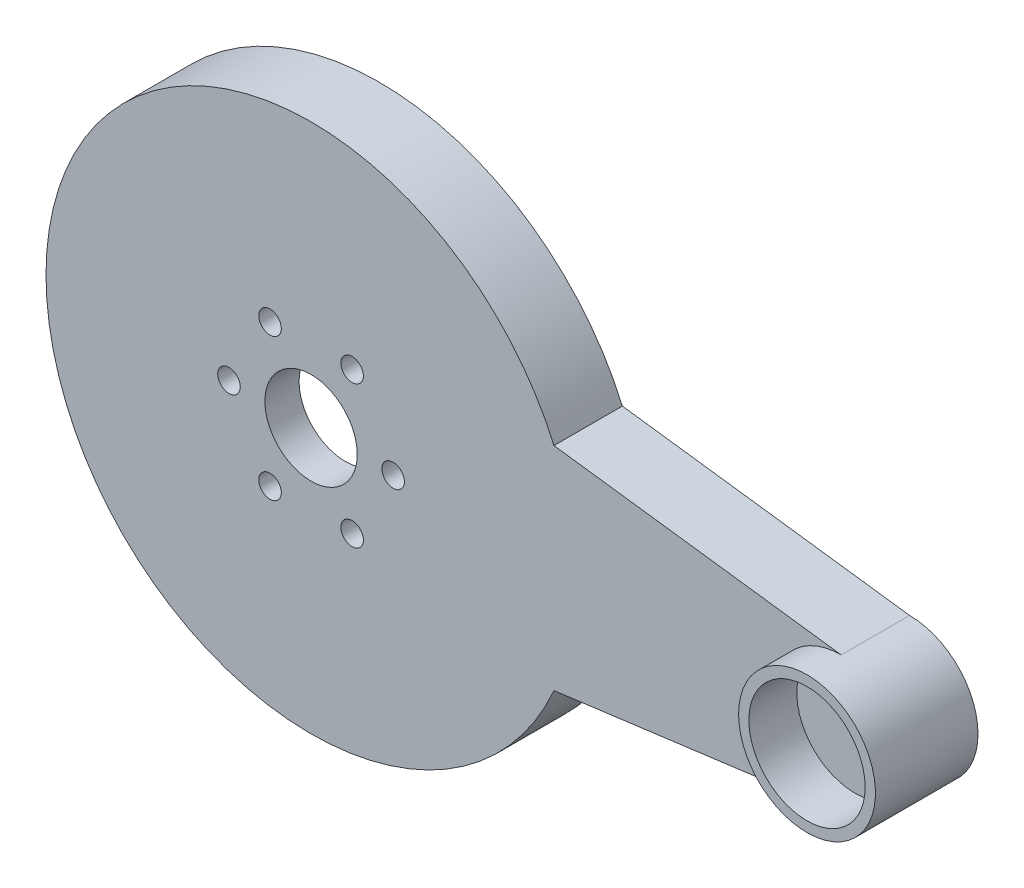
from build123d import *

# Parameters (mm, degrees)
BOSS_EXTRUDE1_DEPTH = 10
SKETCH2_R           = 6.75
SKETCH2_R_2         = 1.65
CUT_EXTRUDE1_DEPTH  = 97.21752699
SKETCH3_W           = 15
SKETCH3_H           = 5
SKETCH4_R           = 10
BOSS_EXTRUDE2_DEPTH = 15
SKETCH5_R           = 8.5
CUT_EXTRUDE2_DEPTH  = 7


with BuildPart() as part:
    # Sketch1 → Boss-Extrude1 (new body)
    with BuildSketch(Plane.XY):
        with BuildLine():
            ThreePointArc((35.510171199, 15.510971646), (-38.75, 0), (35.510171199, -15.510971646))
            Line((35.510171199, -15.510971646), (77.5, -10))
            ThreePointArc((77.5, -10), (87.5, 0), (77.5, 10))
            Line((77.5, 10), (35.510171199, 15.510971646))
        make_face()
    extrude(amount=BOSS_EXTRUDE1_DEPTH)

    # Sketch2 → Cut-Extrude1 (cut, through all)
    with BuildSketch(Plane.XY.offset(10)):
        Circle(SKETCH2_R)
        with Locations((12, 0)):
            Circle(SKETCH2_R_2)
        with Locations((6, -10.392304845)):
            Circle(SKETCH2_R_2)
        with Locations((-6, -10.392304845)):
            Circle(SKETCH2_R_2)
        with Locations((-12, 0)):
            Circle(SKETCH2_R_2)
        with Locations((-6, 10.392304845)):
            Circle(SKETCH2_R_2)
        with Locations((6, 10.392304845)):
            Circle(SKETCH2_R_2)
    extrude(amount=-CUT_EXTRUDE1_DEPTH, mode=Mode.SUBTRACT)

    # Sketch3 → Cut-Revolve1 (revolve, cut)
    with BuildSketch(Plane(origin=(0, 0, 0), x_dir=(1, 0, 0), z_dir=(0, 1, 0))):
        with Locations((7.5, -2.5)):
            Rectangle(SKETCH3_W, SKETCH3_H)
        Polygon((15, -5), (20, 0), (15, 0), align=None)
    revolve(axis=Axis((0, 0, 0), (0, 0, 1)), mode=Mode.SUBTRACT)

    # Sketch4 → Boss-Extrude2 (add)
    with BuildSketch(Plane(origin=(0, 0, 0), x_dir=(-1, 0, 0), z_dir=(0, 0, -1))):
        with Locations((-77.5, 0)):
            Circle(SKETCH4_R)
    extrude(amount=-BOSS_EXTRUDE2_DEPTH)

    # Sketch5 → Cut-Extrude2 (cut)
    with BuildSketch(Plane.XY.offset(15)):
        with Locations((77.5, 0)):
            Circle(SKETCH5_R)
    extrude(amount=-CUT_EXTRUDE2_DEPTH, mode=Mode.SUBTRACT)


solid = part.part
